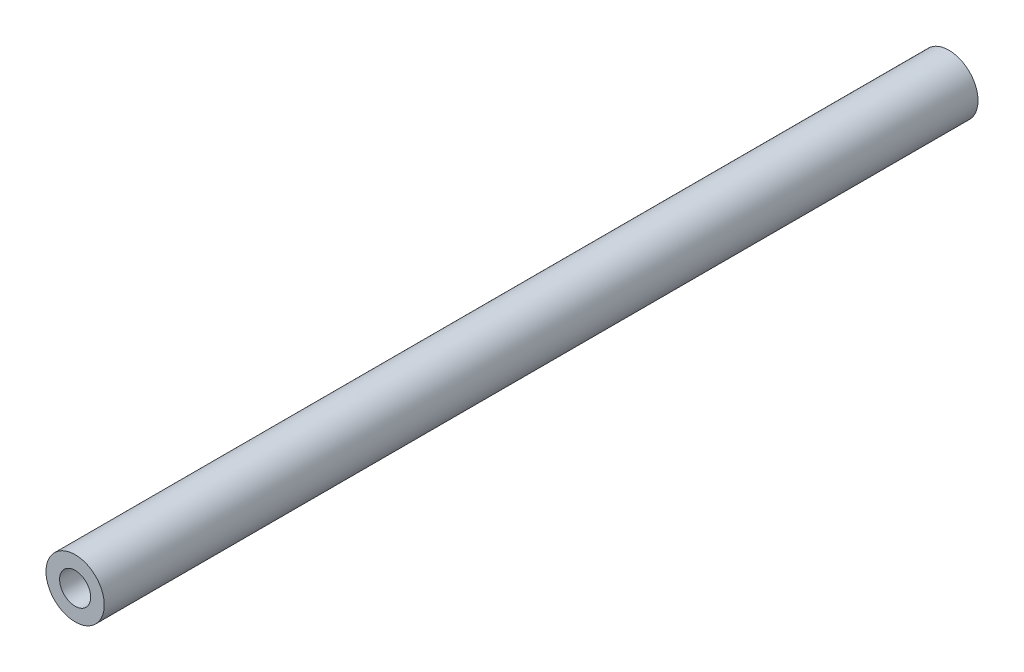
from build123d import *

# Parameters (mm, degrees)
SKIZZE1_R                       = 3
AUFSATZ_LINEAR_AUSTRAGEN1_DEPTH = 90
SKIZZE3_R                       = 1.6
SCHNITT_LINEAR_AUSTRAGEN1_DEPTH = 4.5
SCHNITT_LINEAR_START            = -4.5
SKIZZE4_R                       = 1.6
SCHNITT_LINEAR_AUSTRAGEN2_DEPTH = 4.5


with BuildPart() as part:
    # Skizze1 → Aufsatz-Linear austragen1 (new body)
    with BuildSketch(Plane.XY):
        with Locations(Location((0, 0, 0), (0, 0, 180))):
            Circle(SKIZZE1_R)
    extrude(amount=AUFSATZ_LINEAR_AUSTRAGEN1_DEPTH)

    # Skizze3 → Schnitt-Linear austragen1 (cut)
    with BuildSketch(Plane.XY.offset(90)):
        Circle(SKIZZE3_R)
    extrude(amount=-SCHNITT_LINEAR_AUSTRAGEN1_DEPTH, mode=Mode.SUBTRACT)

    # Skizze4 → Schnitt-Linear austragen2 (cut)
    with BuildSketch(Plane(origin=(0, 0, 0), x_dir=(-1, 0, 0), z_dir=(0, 0, -1)).offset(SCHNITT_LINEAR_START)):
        with Locations(Location((0, 0, 0), (0, 0, 180))):
            Circle(SKIZZE4_R)
    extrude(amount=SCHNITT_LINEAR_AUSTRAGEN2_DEPTH, mode=Mode.SUBTRACT)


solid = part.part
